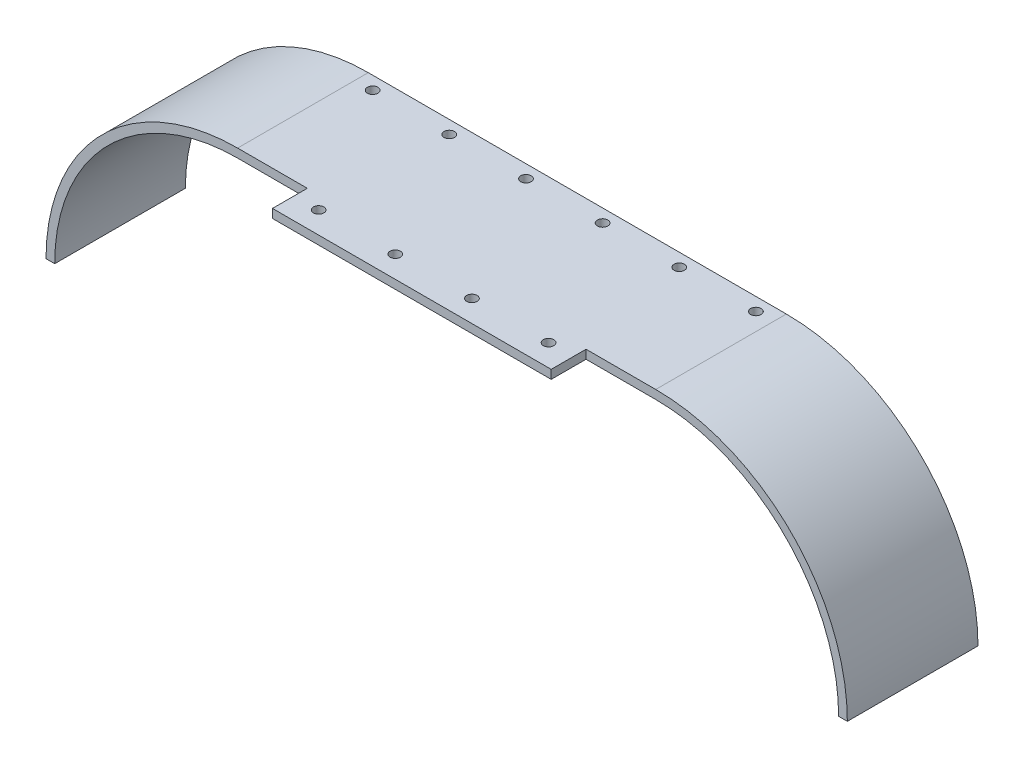
from build123d import *

# Parameters (mm, degrees)
BOSS_EXTRUDE2_DEPTH = 37.5
SKETCH2_W           = 80
SKETCH2_H           = 2.5
BOSS_EXTRUDE3_DEPTH = 10
SKETCH3_R           = 1.5
CUT_EXTRUDE1_DEPTH  = 10
SKETCH4_R           = 1.5
CUT_EXTRUDE2_DEPTH  = 10


with BuildPart() as part:
    # Sketch1 → Boss-Extrude2 (new body)
    with BuildSketch(Plane.XY):
        with BuildLine():
            ThreePointArc((-112.5, 0), (-97.123106012, 37.123106012), (-60, 52.5))
            Line((-60, 52.5), (60, 52.5))
            ThreePointArc((60, 52.5), (97.123106012, 37.123106012), (112.5, 0))
            Line((112.5, 0), (115, 0))
            ThreePointArc((115, 0), (98.890872965, 38.890872965), (60, 55))
            Line((60, 55), (-60, 55))
            ThreePointArc((-60, 55), (-98.890872965, 38.890872965), (-115, 0))
            Line((-115, 0), (-112.5, 0))
        make_face()
    extrude(amount=BOSS_EXTRUDE2_DEPTH)

    # Sketch2 → Boss-Extrude3 (add)
    with BuildSketch(Plane.XY.offset(37.5)):
        with Locations((0, 53.75)):
            Rectangle(SKETCH2_W, SKETCH2_H)
    extrude(amount=BOSS_EXTRUDE3_DEPTH)

    # Sketch3 → Cut-Extrude1 (cut)
    with BuildSketch(Plane(origin=(0, 55, 0), x_dir=(1, 0, 0), z_dir=(0, 1, 0))):
        with Locations(Location((-33, -41.25, 0), (0, 0, 270))):
            Circle(SKETCH3_R)
        with Locations(Location((-11, -41.25, 0), (0, 0, 270))):
            Circle(SKETCH3_R)
        with Locations(Location((11, -41.25, 0), (0, 0, 270))):
            Circle(SKETCH3_R)
        with Locations(Location((33, -41.25, 0), (0, 0, 270))):
            Circle(SKETCH3_R)
    extrude(amount=-CUT_EXTRUDE1_DEPTH, mode=Mode.SUBTRACT)

    # Sketch4 → Cut-Extrude2 (cut)
    with BuildSketch(Plane(origin=(0, 55, 0), x_dir=(1, 0, 0), z_dir=(0, 1, 0))):
        with Locations(Location((-55, -3.75, 0), (0, 0, 270))):
            Circle(SKETCH4_R)
        with Locations(Location((-33, -3.75, 0), (0, 0, 270))):
            Circle(SKETCH4_R)
        with Locations(Location((-11, -3.75, 0), (0, 0, 270))):
            Circle(SKETCH4_R)
        with Locations(Location((11, -3.75, 0), (0, 0, 270))):
            Circle(SKETCH4_R)
        with Locations(Location((33, -3.75, 0), (0, 0, 270))):
            Circle(SKETCH4_R)
        with Locations(Location((55, -3.75, 0), (0, 0, 270))):
            Circle(SKETCH4_R)
    extrude(amount=-CUT_EXTRUDE2_DEPTH, mode=Mode.SUBTRACT)


solid = part.part
